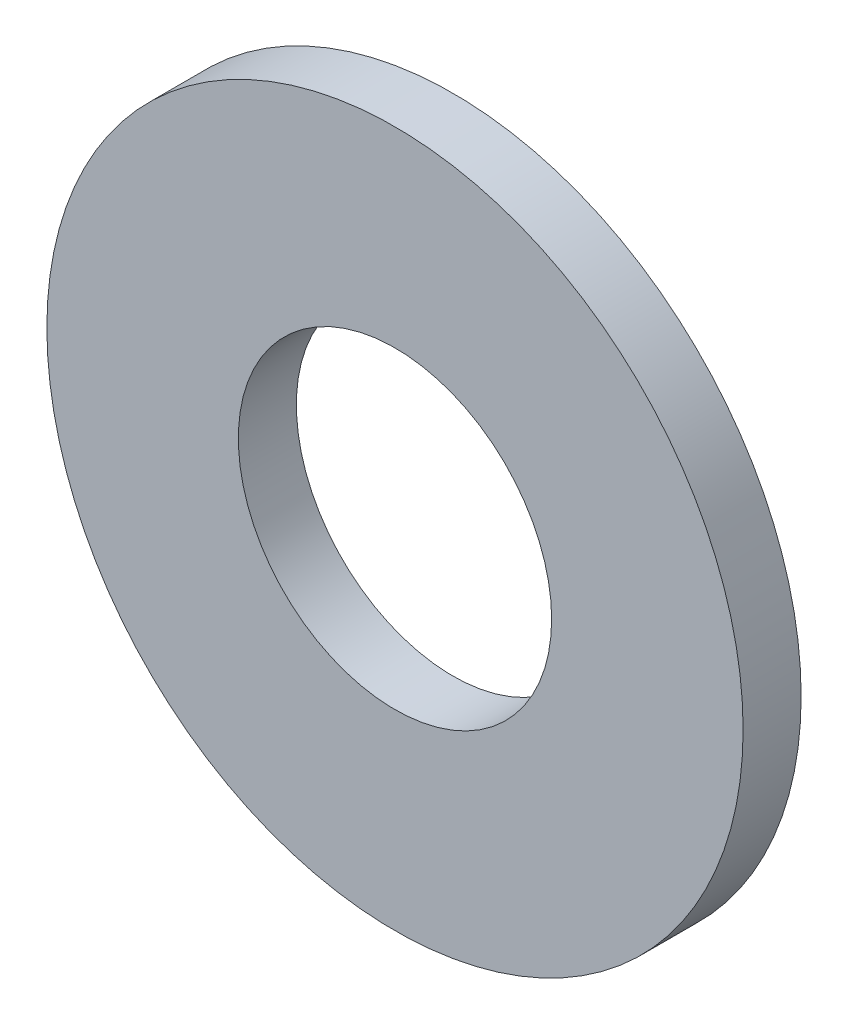
from build123d import *

# Parameters (mm, degrees)
ESQUISSE1_W = 1.65
ESQUISSE1_H = 0.5


with BuildPart() as part:
    # Esquisse1 → Révolution1 (revolve)
    with BuildSketch(Plane(origin=(0, 0, 0), x_dir=(1, 0, 0), z_dir=(0, 1, 0))):
        with Locations((2.175, -0.25)):
            Rectangle(ESQUISSE1_W, ESQUISSE1_H)
    revolve(axis=Axis((0, 0, 0), (0, 0, 1)))


solid = part.part
